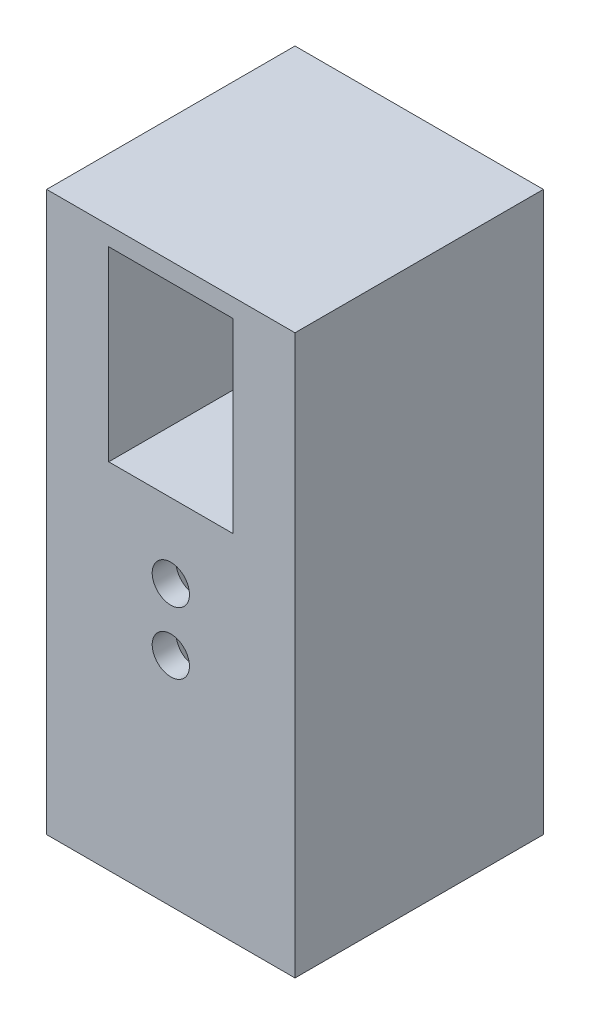
from build123d import *

# Parameters (mm, degrees)
SKETCH5_W           = 101.6
SKETCH5_H           = 101.6
BOSS_EXTRUDE1_DEPTH = 228.6
SKETCH6_R           = 41.91
CUT_EXTRUDE1_DEPTH  = 127
SKETCH5_3_W         = 20.32
SKETCH5_3_H         = 20.32
CUT_EXTRUDE2_DEPTH  = 25.4
CUT_EXTRUDE3_DEPTH  = 76.2
SKETCH9_R           = 7.62
CUT_EXTRUDE4_DEPTH  = 56.642


with BuildPart() as part:
    # Sketch5 → Boss-Extrude1 (new body)
    with BuildSketch(Plane(origin=(0, 0, 0), x_dir=(1, 0, 0), z_dir=(0, 1, 0))):
        with Locations((50.8, 50.8)):
            Rectangle(SKETCH5_W, SKETCH5_H)
    extrude(amount=BOSS_EXTRUDE1_DEPTH)

    # Sketch6 → Cut-Extrude1 (cut)
    with BuildSketch(Plane(origin=(0, 0, 0), x_dir=(1, 0, 0), z_dir=(0, 1, 0))):
        with Locations((50.8, 50.8)):
            Circle(SKETCH6_R)
    extrude(amount=CUT_EXTRUDE1_DEPTH, mode=Mode.SUBTRACT)

    # Sketch5<3> → Cut-Extrude2 (cut)
    with BuildSketch(Plane(origin=(0, 0, 0), x_dir=(1, 0, 0), z_dir=(0, 1, 0))):
        with Locations((85.09, 15.457317153)):
            Rectangle(SKETCH5_3_W, SKETCH5_3_H)
        with Locations((16.51, 15.457317153)):
            Rectangle(SKETCH5_3_W, SKETCH5_3_H)
        with Locations((85.09, 85.09)):
            Rectangle(SKETCH5_3_W, SKETCH5_3_H)
        with Locations((16.51, 85.09)):
            Rectangle(SKETCH5_3_W, SKETCH5_3_H)
    extrude(amount=CUT_EXTRUDE2_DEPTH, mode=Mode.SUBTRACT)

    # Sketch7 → Cut-Extrude3 (cut)
    with BuildSketch(Plane(origin=(0, 220.98, 0), x_dir=(1, 0, 0), z_dir=(0, 1, 0))):
        with BuildLine():
            Line((76.2, 50.8), (76.2, -137.296764807))
            Line((76.2, -137.296764807), (25.4, -137.296764807))
            Line((25.4, -137.296764807), (25.4, 50.8))
            ThreePointArc((25.4, 50.8), (50.8, 76.2), (76.2, 50.8))
        make_face()
    extrude(amount=-CUT_EXTRUDE3_DEPTH, mode=Mode.SUBTRACT)

    # Sketch9 → Cut-Extrude4 (cut)
    with BuildSketch(Plane.XY):
        with Locations((50.8, 114.3)):
            Circle(SKETCH9_R)
        with Locations((50.8, 88.9)):
            Circle(SKETCH9_R)
    extrude(amount=-CUT_EXTRUDE4_DEPTH, mode=Mode.SUBTRACT)


solid = part.part
